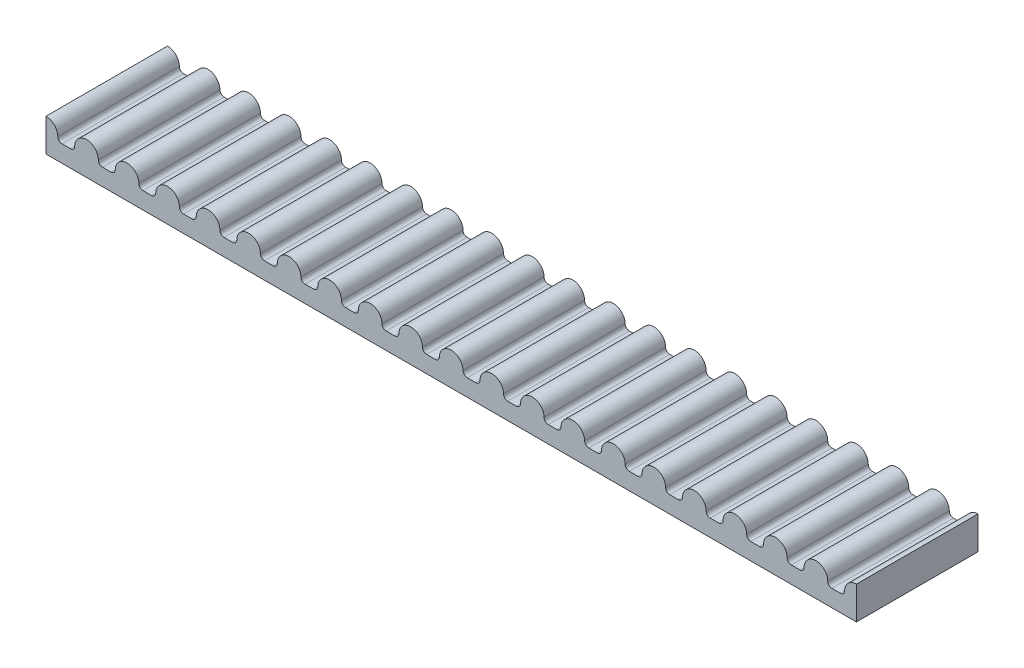
from build123d import *

# Parameters (mm, degrees)
BOSS_EXTRUDE1_DEPTH = 9
LPATTERN1_COUNT     = 20
LPATTERN1_PITCH     = 3


with BuildPart() as part:
    # Sketch1 → Boss-Extrude1 (new body)
    with BuildSketch(Plane.XY):
        with BuildLine():
            Line((0, 0), (3, 0))
            Line((3, 0), (3, 2.43))
            ThreePointArc((3, 2.43), (2.381281566, 2.173718434), (2.125, 1.555))
            ThreePointArc((2.125, 1.555), (2.035667568, 1.339332432), (1.82, 1.25))
            Line((1.82, 1.25), (1.18, 1.25))
            ThreePointArc((1.18, 1.25), (0.964332432, 1.339332432), (0.875, 1.555))
            ThreePointArc((0.875, 1.555), (0.618718434, 2.173718434), (0, 2.43))
            Line((0, 2.43), (0, 1.25))
            Line((0, 1.25), (0, 0))
        make_face()
    boss_extrude1 = extrude(amount=BOSS_EXTRUDE1_DEPTH)

    # LPattern1: Boss-Extrude1 ×20
    with Locations(*[(-i * LPATTERN1_PITCH, 0, 0) for i in range(1, LPATTERN1_COUNT)]):
        add(boss_extrude1)


solid = part.part
